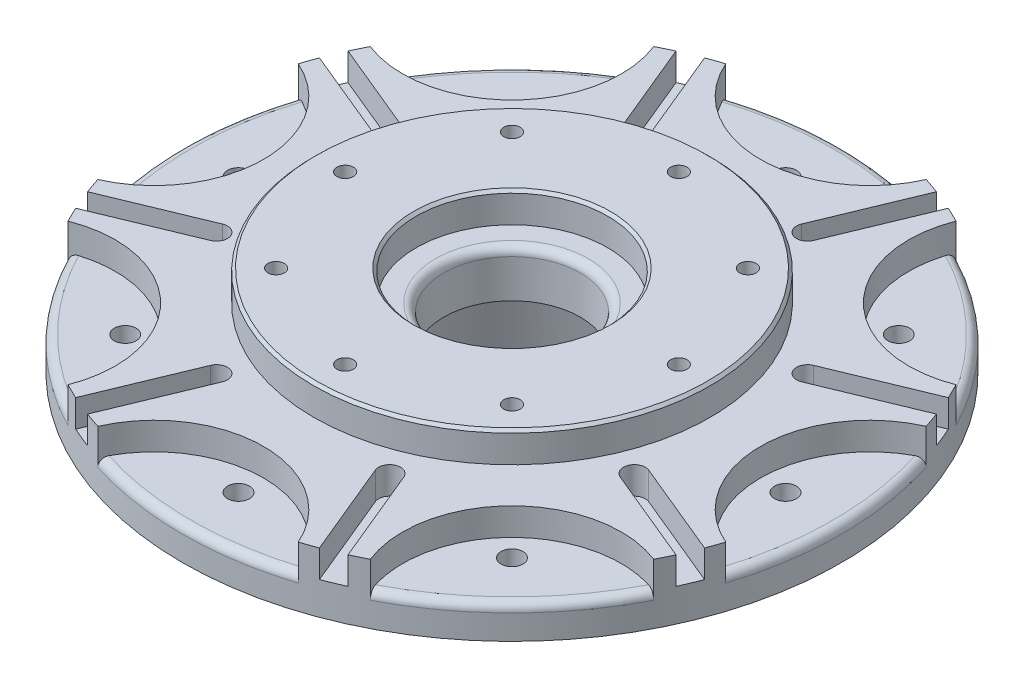
from build123d import *

# Parameters (mm, degrees)
SKETCH2_R           = 72.5
BOSS_EXTRUDE5_DEPTH = 11
SKETCH2_8_R         = 120.5
SKETCH2_8_R_2       = 72.5
BOSS_EXTRUDE6_DEPTH = 22
SKETCH4_R           = 74
BOSS_EXTRUDE7_DEPTH = 54
SKETCH5_R           = 35
CUT_EXTRUDE2_DEPTH  = 11
CHAMFER1_SIZE       = 1
SKETCH6_R           = 25
CUT_EXTRUDE3_DEPTH  = 65
FILLET1_R           = 3
SKETCH7_R           = 40
CUT_EXTRUDE4_DEPTH  = 10
FILLET2_R           = 3
CHAMFER2_SIZE       = 1
SKETCH8_R           = 43
CUT_EXTRUDE5_DEPTH  = 44
SKETCH9_R           = 49.17
CUT_EXTRUDE8_DEPTH  = 35
CUT_EXTRUDE8_DRAFT  = -10
SKETCH12_R          = 35
SKETCH12_R_2        = 25
BOSS_EXTRUDE9_DEPTH = 7
CUT_EXTRUDE9_DEPTH  = 10
SKETCH14_R          = 3
CUT_EXTRUDE10_DEPTH = 21
SKETCH15_R          = 6
CUT_EXTRUDE11_DEPTH = 44
SKETCH16_R          = 4
CUT_EXTRUDE14_DEPTH = 44


with BuildPart() as part:
    # Sketch2 → Boss-Extrude5 (new body)
    with BuildSketch(Plane(origin=(0, 0, 0), x_dir=(1, 0, 0), z_dir=(0, 1, 0))):
        Circle(SKETCH2_R)
    extrude(amount=BOSS_EXTRUDE5_DEPTH)



with BuildPart() as body_2:
    # Sketch2<8> → Boss-Extrude6 (new body)
    with BuildSketch(Plane(origin=(0, 0, 0), x_dir=(1, 0, 0), z_dir=(0, 1, 0))):
        Circle(SKETCH2_8_R)
        Circle(SKETCH2_8_R_2, mode=Mode.SUBTRACT)
    extrude(amount=-BOSS_EXTRUDE6_DEPTH)


with BuildPart() as part_1:
    add(part.part)

    add(body_2.part)  # Boss-Extrude7 merges body 2
    # Sketch4 → Boss-Extrude7 (add)
    with BuildSketch(Plane.XZ):
        Circle(SKETCH4_R)
    extrude(amount=BOSS_EXTRUDE7_DEPTH)

    # Sketch5 → Cut-Extrude2 (cut)
    with BuildSketch(Plane(origin=(0, 11, 0), x_dir=(1, 0, 0), z_dir=(0, 1, 0))):
        Circle(SKETCH5_R)
    extrude(amount=-CUT_EXTRUDE2_DEPTH, mode=Mode.SUBTRACT)

    # Chamfer1
    chamfer1_edges = [part_1.edges().sort_by_distance(p)[0] for p in [
        (-35, 11, 0),
    ]]
    chamfer(chamfer1_edges, length=CHAMFER1_SIZE)

    # Sketch6 → Cut-Extrude3 (cut)
    with BuildSketch(Plane(origin=(0, 0, 0), x_dir=(1, 0, 0), z_dir=(0, 1, 0))):
        Circle(SKETCH6_R)
    extrude(amount=-CUT_EXTRUDE3_DEPTH, mode=Mode.SUBTRACT)

    # Fillet1
    fillet1_edges = [part_1.edges().sort_by_distance(p)[0] for p in [
        (-25, 0, 0),
    ]]
    fillet(fillet1_edges, radius=FILLET1_R)

    # Sketch7 → Cut-Extrude4 (cut)
    with BuildSketch(Plane(origin=(0, 0, 0), x_dir=(1, 0, 0), z_dir=(0, 1, 0))):
        with Locations((0, 130.84)):
            Circle(SKETCH7_R)
        with Locations((92.51785125, 92.51785125)):
            Circle(SKETCH7_R)
        with Locations((130.84, 0)):
            Circle(SKETCH7_R)
        with Locations((92.51785125, -92.51785125)):
            Circle(SKETCH7_R)
        with Locations((0, -130.84)):
            Circle(SKETCH7_R)
        with Locations((-92.51785125, -92.51785125)):
            Circle(SKETCH7_R)
        with Locations((-130.84, 0)):
            Circle(SKETCH7_R)
        with Locations((-92.51785125, 92.51785125)):
            Circle(SKETCH7_R)
    extrude(amount=-CUT_EXTRUDE4_DEPTH, mode=Mode.SUBTRACT)

    # Fillet2
    fillet2_edges = [part_1.edges().sort_by_distance(p)[0] for p in [
        (0, -10, -120.5),
        (85.206367133, -10, -85.206367133),
        (119.065014599, -10, -18.541097557),
        (85.206367133, -10, 85.206367133),
        (0, -10, 120.5),
        (-85.206367133, -10, 85.206367133),
        (-120.5, -10, 0),
        (-85.206367133, -10, -85.206367133),
    ]]
    fillet(fillet2_edges, radius=FILLET2_R)

    # Chamfer2
    chamfer2_edges = [part_1.edges().sort_by_distance(p)[0] for p in [
        (-72.5, 11, 0),
    ]]
    chamfer(chamfer2_edges, length=CHAMFER2_SIZE)

    # Sketch8 → Cut-Extrude5 (cut)
    with BuildSketch(Plane.XZ.offset(54)):
        Circle(SKETCH8_R)
    extrude(amount=-CUT_EXTRUDE5_DEPTH, mode=Mode.SUBTRACT)


with BuildPart() as cut_extrude8_tool:
    # Sketch9 → Cut-Extrude8 (with draft: the straight prism first)
    with BuildSketch(Plane.XZ.offset(54)):
        Circle(SKETCH9_R)
    extrude(amount=-CUT_EXTRUDE8_DEPTH)
    # Cut-Extrude8: the draft: its side faces are tilted about the plane it starts from
    cut_extrude8_sides = [cut_extrude8_tool.faces().sort_by_distance(p)[0] for p in [
        (-49.17, -36.5, 0),
    ]]
    draft(cut_extrude8_sides, Plane.XZ.offset(54), CUT_EXTRUDE8_DRAFT)


with BuildPart() as part_2:
    add(part_1.part)

    # Cut-Extrude8: cut by cut_extrude8_tool
    add(cut_extrude8_tool.part, mode=Mode.SUBTRACT)

    # Sketch12 → Boss-Extrude9 (add)
    with BuildSketch(Plane.XZ.offset(10)):
        Circle(SKETCH12_R)
        Circle(SKETCH12_R_2, mode=Mode.SUBTRACT)
    extrude(amount=BOSS_EXTRUDE9_DEPTH)

    # Sketch13 → Cut-Extrude9 (cut)
    with BuildSketch(Plane(origin=(0, 0, 0), x_dir=(1, 0, 0), z_dir=(0, 1, 0))):
        with BuildLine():
            Line((-35.343437987, -74.874103609), (-49.885408417, -109.981525845))
            ThreePointArc((-49.885408417, -109.981525845), (-47.720624016, -115.207777704), (-42.494372156, -113.042993304))
            Line((-42.494372156, -113.042993304), (-27.952401727, -77.935571068))
            ThreePointArc((-27.952401727, -77.935571068), (-30.117186127, -72.709319209), (-35.343437987, -74.874103609))
        make_face()
        with BuildLine():
            Line((-77.935571068, -27.952401727), (-113.042993304, -42.494372156))
            ThreePointArc((-113.042993304, -42.494372156), (-115.207777704, -47.720624016), (-109.981525845, -49.885408417))
            Line((-109.981525845, -49.885408417), (-74.874103609, -35.343437987))
            ThreePointArc((-74.874103609, -35.343437987), (-72.709319209, -30.117186127), (-77.935571068, -27.952401727))
        make_face()
        with BuildLine():
            Line((-74.874103609, 35.343437987), (-109.981525845, 49.885408417))
            ThreePointArc((-109.981525845, 49.885408417), (-115.207777704, 47.720624016), (-113.042993304, 42.494372156))
            Line((-113.042993304, 42.494372156), (-77.935571068, 27.952401727))
            ThreePointArc((-77.935571068, 27.952401727), (-72.709319209, 30.117186127), (-74.874103609, 35.343437987))
        make_face()
        with BuildLine():
            Line((-27.952401727, 77.935571068), (-42.494372156, 113.042993304))
            ThreePointArc((-42.494372156, 113.042993304), (-47.720624016, 115.207777704), (-49.885408417, 109.981525845))
            Line((-49.885408417, 109.981525845), (-35.343437987, 74.874103609))
            ThreePointArc((-35.343437987, 74.874103609), (-30.117186127, 72.709319209), (-27.952401727, 77.935571068))
        make_face()
        with BuildLine():
            Line((35.343437987, 74.874103609), (49.885408417, 109.981525845))
            ThreePointArc((49.885408417, 109.981525845), (47.720624016, 115.207777704), (42.494372156, 113.042993304))
            Line((42.494372156, 113.042993304), (27.952401727, 77.935571068))
            ThreePointArc((27.952401727, 77.935571068), (30.117186127, 72.709319209), (35.343437987, 74.874103609))
        make_face()
        with BuildLine():
            Line((77.935571068, 27.952401727), (113.042993304, 42.494372156))
            ThreePointArc((113.042993304, 42.494372156), (115.207777704, 47.720624016), (109.981525845, 49.885408417))
            Line((109.981525845, 49.885408417), (74.874103609, 35.343437987))
            ThreePointArc((74.874103609, 35.343437987), (72.709319209, 30.117186127), (77.935571068, 27.952401727))
        make_face()
        with BuildLine():
            Line((74.874103609, -35.343437987), (109.981525845, -49.885408417))
            ThreePointArc((109.981525845, -49.885408417), (115.207777704, -47.720624016), (113.042993304, -42.494372156))
            Line((113.042993304, -42.494372156), (77.935571068, -27.952401727))
            ThreePointArc((77.935571068, -27.952401727), (72.709319209, -30.117186127), (74.874103609, -35.343437987))
        make_face()
        with BuildLine():
            Line((27.952401727, -77.935571068), (42.494372156, -113.042993304))
            ThreePointArc((42.494372156, -113.042993304), (47.720624016, -115.207777704), (49.885408417, -109.981525845))
            Line((49.885408417, -109.981525845), (35.343437987, -74.874103609))
            ThreePointArc((35.343437987, -74.874103609), (30.117186127, -72.709319209), (27.952401727, -77.935571068))
        make_face()
    extrude(amount=-CUT_EXTRUDE9_DEPTH, mode=Mode.SUBTRACT)

    # Sketch14 → Cut-Extrude10 (cut)
    with BuildSketch(Plane(origin=(0, 11, 0), x_dir=(1, 0, 0), z_dir=(0, 1, 0))):
        with Locations((-61, 0)):
            Circle(SKETCH14_R)
        with Locations((-43.133513652, 43.133513652)):
            Circle(SKETCH14_R)
        with Locations((0, 61)):
            Circle(SKETCH14_R)
        with Locations((43.133513652, 43.133513652)):
            Circle(SKETCH14_R)
        with Locations((61, 0)):
            Circle(SKETCH14_R)
        with Locations((43.133513652, -43.133513652)):
            Circle(SKETCH14_R)
        with Locations((0, -61)):
            Circle(SKETCH14_R)
        with Locations((-43.133513652, -43.133513652)):
            Circle(SKETCH14_R)
    extrude(amount=-CUT_EXTRUDE10_DEPTH, mode=Mode.SUBTRACT)

    # Sketch15 → Cut-Extrude11 (cut)
    with BuildSketch(Plane.XZ.offset(54)):
        with Locations((-61, 0)):
            Circle(SKETCH15_R)
        with Locations((-43.133513652, 43.133513652)):
            Circle(SKETCH15_R)
        with Locations((0, 61)):
            Circle(SKETCH15_R)
        with Locations((43.133513652, 43.133513652)):
            Circle(SKETCH15_R)
        with Locations((61, 0)):
            Circle(SKETCH15_R)
        with Locations((43.133513652, -43.133513652)):
            Circle(SKETCH15_R)
        with Locations((0, -61)):
            Circle(SKETCH15_R)
        with Locations((-43.133513652, -43.133513652)):
            Circle(SKETCH15_R)
    extrude(amount=-CUT_EXTRUDE11_DEPTH, mode=Mode.SUBTRACT)

    # Sketch16 → Cut-Extrude14 (cut)
    with BuildSketch(Plane(origin=(0, -10, 0), x_dir=(1, 0, 0), z_dir=(0, 1, 0))):
        with Locations((0, -100)):
            Circle(SKETCH16_R)
        with Locations((-70.710678119, -70.710678119)):
            Circle(SKETCH16_R)
        with Locations((-100, 0)):
            Circle(SKETCH16_R)
        with Locations((-70.710678119, 70.710678119)):
            Circle(SKETCH16_R)
        with Locations((0, 100)):
            Circle(SKETCH16_R)
        with Locations((70.710678119, 70.710678119)):
            Circle(SKETCH16_R)
        with Locations((100, 0)):
            Circle(SKETCH16_R)
        with Locations((70.710678119, -70.710678119)):
            Circle(SKETCH16_R)
    extrude(amount=-CUT_EXTRUDE14_DEPTH, mode=Mode.SUBTRACT)


solid = part_2.part
